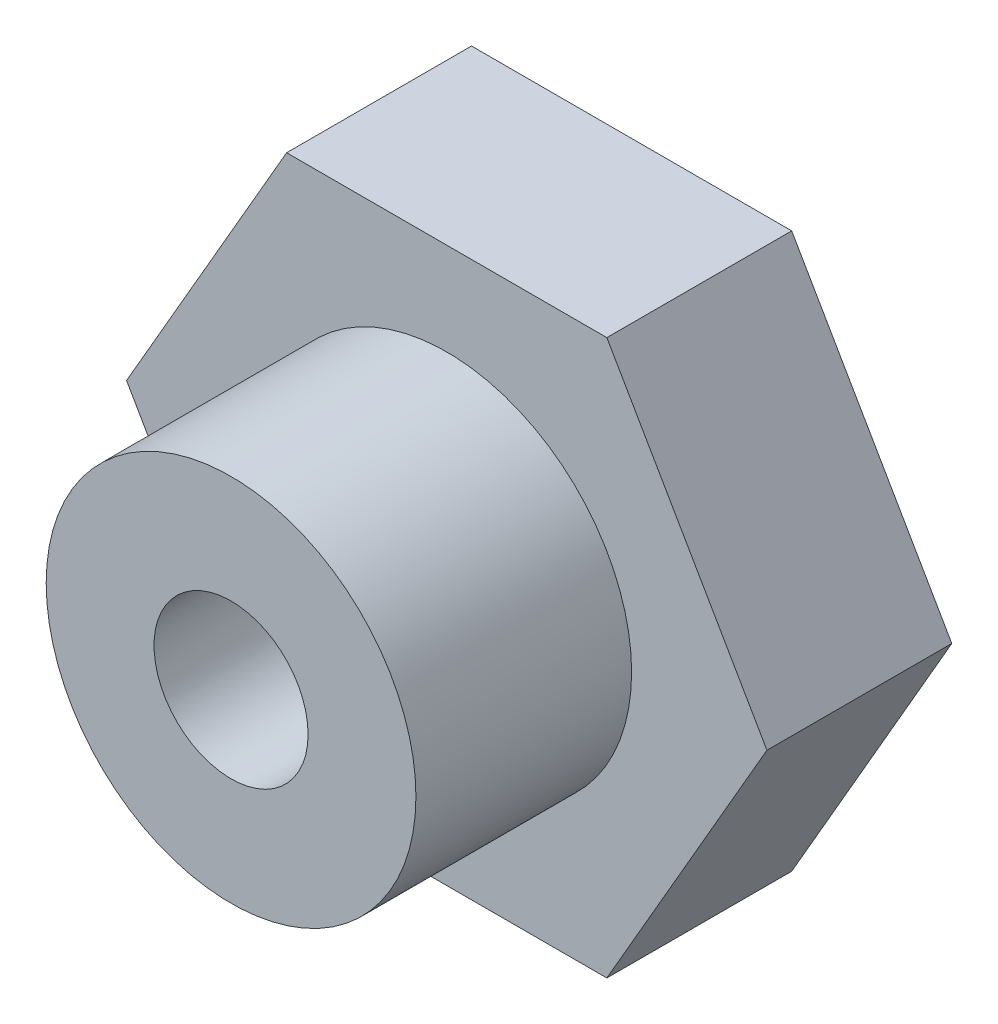
from build123d import *

# Parameters (mm, degrees)
SKETCH1_R           = 2.5
BOSS_EXTRUDE1_DEPTH = 6
BOSS_EXTRUDE2_START = 7
SKETCH1_3_R         = 6
SKETCH1_3_R_2       = 2.5
BOSS_EXTRUDE2_DEPTH = 7


with BuildPart() as part:
    # Sketch1 → Boss-Extrude1 (new body)
    with BuildSketch(Plane.XY):
        Polygon((5.196152423, -9), (10.392304845, 0), (5.196152423, 9), (-5.196152423, 9), (-10.392304845, 0), (-5.196152423, -9), align=None)
        Circle(SKETCH1_R, mode=Mode.SUBTRACT)
    extrude(amount=-BOSS_EXTRUDE1_DEPTH)

    # Sketch1<3> → Boss-Extrude2 (add)
    with BuildSketch(Plane.XY.offset(BOSS_EXTRUDE2_START)):
        Circle(SKETCH1_3_R)
        Circle(SKETCH1_3_R_2, mode=Mode.SUBTRACT)
    extrude(amount=-BOSS_EXTRUDE2_DEPTH)


solid = part.part
